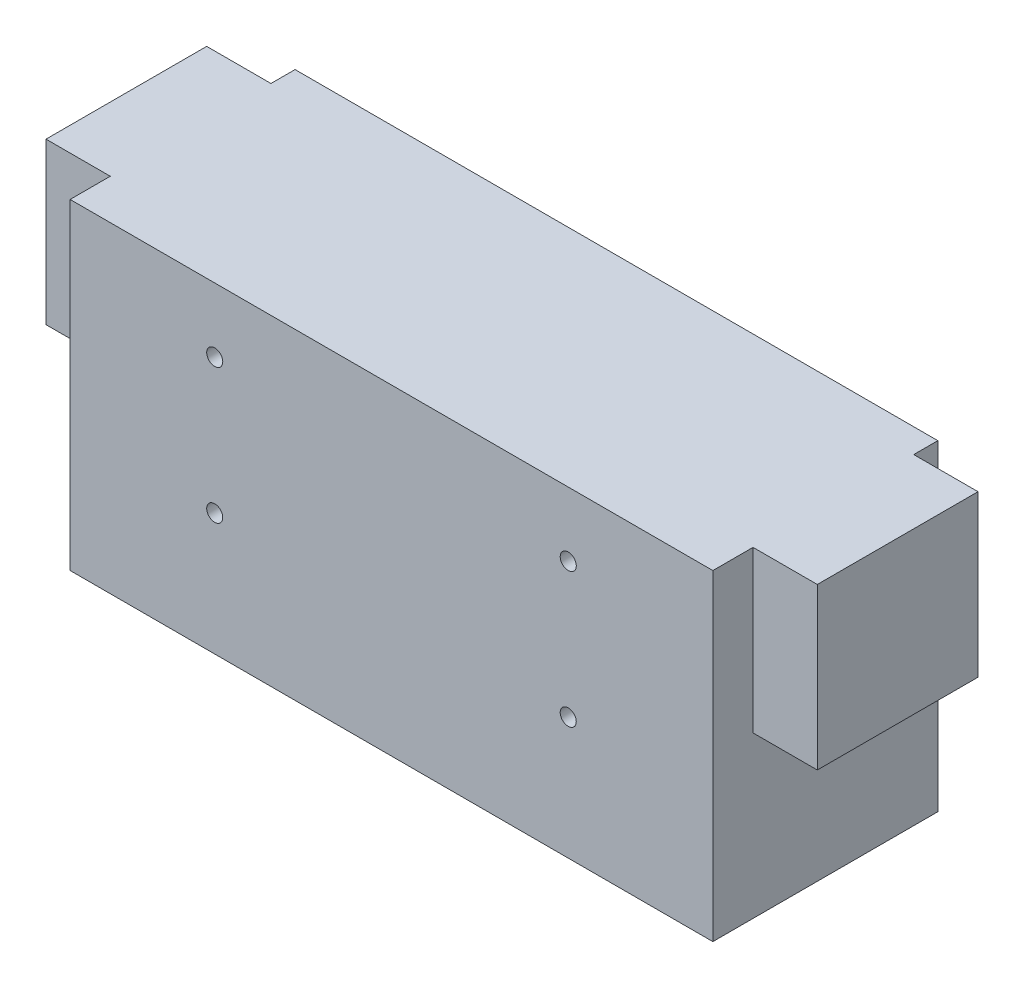
from build123d import *

# Parameters (mm, degrees)
SKETCH1_W           = 200
SKETCH1_H           = 70
BOSS_EXTRUDE1_DEPTH = 100
SKETCH2_W           = 20
SKETCH2_H           = 50
BOSS_EXTRUDE3_DEPTH = 50
SKETCH3_W           = 25
SKETCH3_H           = 30
CUT_EXTRUDE1_DEPTH  = 25
SKETCH4_R           = 2.5
CUT_EXTRUDE2_DEPTH  = 15
SKETCH5_R           = 3.75
CUT_EXTRUDE3_DEPTH  = 4
SKETCH6_R           = 2
CUT_EXTRUDE4_DEPTH  = 15
SKETCH7_W           = 180
SKETCH7_H           = 62
CUT_EXTRUDE5_DEPTH  = 60
SKETCH8_R           = 2
CUT_EXTRUDE6_DEPTH  = 15
SKETCH9_R           = 2.5
CUT_EXTRUDE7_DEPTH  = 168.332005307
SKETCH10_R          = 3.75
CUT_EXTRUDE8_DEPTH  = 4


with BuildPart() as part:
    # Sketch1 → Boss-Extrude1 (new body)
    with BuildSketch(Plane(origin=(0, 0, 0), x_dir=(1, 0, 0), z_dir=(0, 1, 0))):
        Rectangle(SKETCH1_W, SKETCH1_H)
    extrude(amount=BOSS_EXTRUDE1_DEPTH)

    # Sketch2 → Boss-Extrude3 (add)
    with BuildSketch(Plane(origin=(0, 100, 0), x_dir=(1, 0, 0), z_dir=(0, 1, 0))):
        with Locations((-110, 2.5)):
            Rectangle(SKETCH2_W, SKETCH2_H)
        with Locations((110, 2.5)):
            Rectangle(SKETCH2_W, SKETCH2_H)
    extrude(amount=-BOSS_EXTRUDE3_DEPTH)

    # Sketch3 → Cut-Extrude1 (cut)
    with BuildSketch(Plane.XZ):
        with Locations((77.5, -15)):
            Rectangle(SKETCH3_W, SKETCH3_H)
        with Locations((-77.5, -15)):
            Rectangle(SKETCH3_W, SKETCH3_H)
    extrude(amount=-CUT_EXTRUDE1_DEPTH, mode=Mode.SUBTRACT)

    # Sketch4 → Cut-Extrude2 (cut)
    with BuildSketch(Plane(origin=(0, 0, -35), x_dir=(-1, 0, 0), z_dir=(0, 0, -1))):
        with Locations((-77.5, 12.5)):
            Circle(SKETCH4_R)
        with Locations((77.5, 12.5)):
            Circle(SKETCH4_R)
    extrude(amount=-CUT_EXTRUDE2_DEPTH, mode=Mode.SUBTRACT)

    # Sketch5 → Cut-Extrude3 (cut)
    with BuildSketch(Plane(origin=(0, 0, -35), x_dir=(-1, 0, 0), z_dir=(0, 0, -1))):
        with Locations((-77.5, 12.5)):
            Circle(SKETCH5_R)
        with Locations(Location((77.5, 12.5, 0), (0, 0, 180))):
            Circle(SKETCH5_R)
    extrude(amount=-CUT_EXTRUDE3_DEPTH, mode=Mode.SUBTRACT)

    # Sketch6 → Cut-Extrude4 (cut)
    with BuildSketch(Plane(origin=(0, 0, -27.5), x_dir=(-1, 0, 0), z_dir=(0, 0, -1))):
        with Locations((-110, 87.5)):
            Circle(SKETCH6_R)
        with Locations(Location((-110, 62.5, 0), (0, 0, 180))):
            Circle(SKETCH6_R)
        with Locations((110, 62.5)):
            Circle(SKETCH6_R)
        with Locations(Location((110, 87.5, 0), (0, 0, 180))):
            Circle(SKETCH6_R)
    extrude(amount=-CUT_EXTRUDE4_DEPTH, mode=Mode.SUBTRACT)

    # Sketch7 → Cut-Extrude5 (cut)
    with BuildSketch(Plane(origin=(0, 0, -35), x_dir=(-1, 0, 0), z_dir=(0, 0, -1))):
        with Locations((0, 59)):
            Rectangle(SKETCH7_W, SKETCH7_H)
    extrude(amount=-CUT_EXTRUDE5_DEPTH, mode=Mode.SUBTRACT)

    # Sketch8 → Cut-Extrude6 (cut)
    with BuildSketch(Plane(origin=(0, 0, -35), x_dir=(-1, 0, 0), z_dir=(0, 0, -1))):
        with Locations((-45, 15)):
            Circle(SKETCH8_R)
        with Locations(Location((45, 15, 0), (0, 0, 180))):
            Circle(SKETCH8_R)
        with Locations((-93, 93)):
            Circle(SKETCH8_R)
        with Locations(Location((93, 93, 0), (0, 0, 180))):
            Circle(SKETCH8_R)
    extrude(amount=-CUT_EXTRUDE6_DEPTH, mode=Mode.SUBTRACT)

    # Sketch9 → Cut-Extrude7 (cut, through all)
    with BuildSketch(Plane(origin=(0, 0, 25), x_dir=(-1, 0, 0), z_dir=(0, 0, -1))):
        with Locations((-55, 80)):
            Circle(SKETCH9_R)
        with Locations(Location((55, 80, 0), (0, 0, 180))):
            Circle(SKETCH9_R)
        with Locations((55, 38)):
            Circle(SKETCH9_R)
        with Locations(Location((-55, 38, 0), (0, 0, 180))):
            Circle(SKETCH9_R)
    extrude(amount=-CUT_EXTRUDE7_DEPTH, mode=Mode.SUBTRACT)

    # Sketch10 → Cut-Extrude8 (cut)
    with BuildSketch(Plane(origin=(0, 0, 25), x_dir=(-1, 0, 0), z_dir=(0, 0, -1))):
        with Locations((-55, 80)):
            Circle(SKETCH10_R)
        with Locations(Location((-55, 38, 0), (0, 0, 180))):
            Circle(SKETCH10_R)
        with Locations((55, 38)):
            Circle(SKETCH10_R)
        with Locations(Location((55, 80, 0), (0, 0, 180))):
            Circle(SKETCH10_R)
    extrude(amount=-CUT_EXTRUDE8_DEPTH, mode=Mode.SUBTRACT)


solid = part.part
